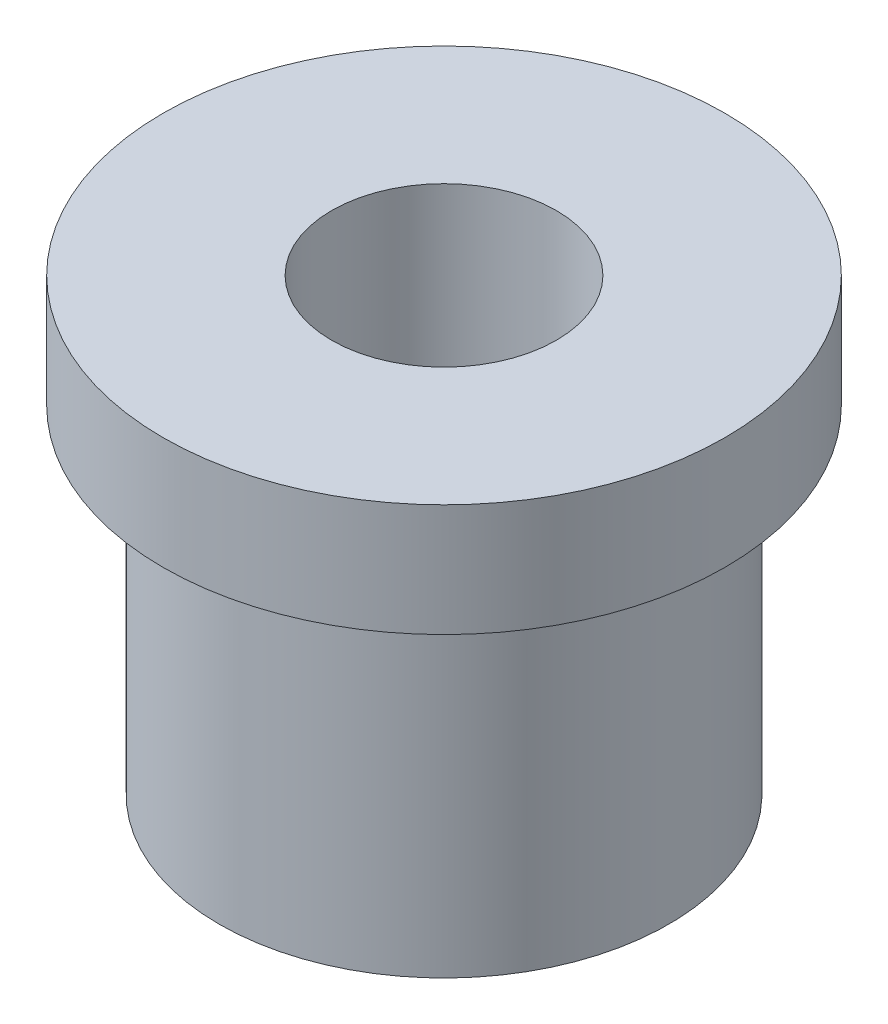
from build123d import *

# Parameters (mm, degrees)
CUT_EXTRUDE1_REACH = 28.693
SKETCH2_R          = 5


with BuildPart() as part:
    # Sketch1 → Revolve1 (revolve)
    with BuildSketch(Plane.XY, mode=Mode.PRIVATE) as revolve1_sk:
        Polygon((0, 0), (12.5, 0), (12.5, -5), (10, -5), (10, -20), (0, -20), align=None)
    revolve(revolve1_sk.sketch.rotate(Axis((0, -25, 0), (0, 1, 0)), 90), axis=Axis((0, -25, 0), (0, 1, 0)))

    # Sketch2 → Cut-Extrude1 (cut, up to next)
    with BuildSketch(Plane(origin=(0, 0, 0), x_dir=(1, 0, 0), z_dir=(0, 1, 0)), mode=Mode.PRIVATE) as cut_extrude1_sk1:
        with Locations(Location((0, 0, 0), (0, 0, 180))):
            Circle(SKETCH2_R)
    cut_extrude1_tool1 = extrude(cut_extrude1_sk1.sketch, amount=-CUT_EXTRUDE1_REACH, mode=Mode.PRIVATE) & part.part
    add(cut_extrude1_tool1.solids().sort_by_distance((0, 0, 0))[0], mode=Mode.SUBTRACT)


solid = part.part
